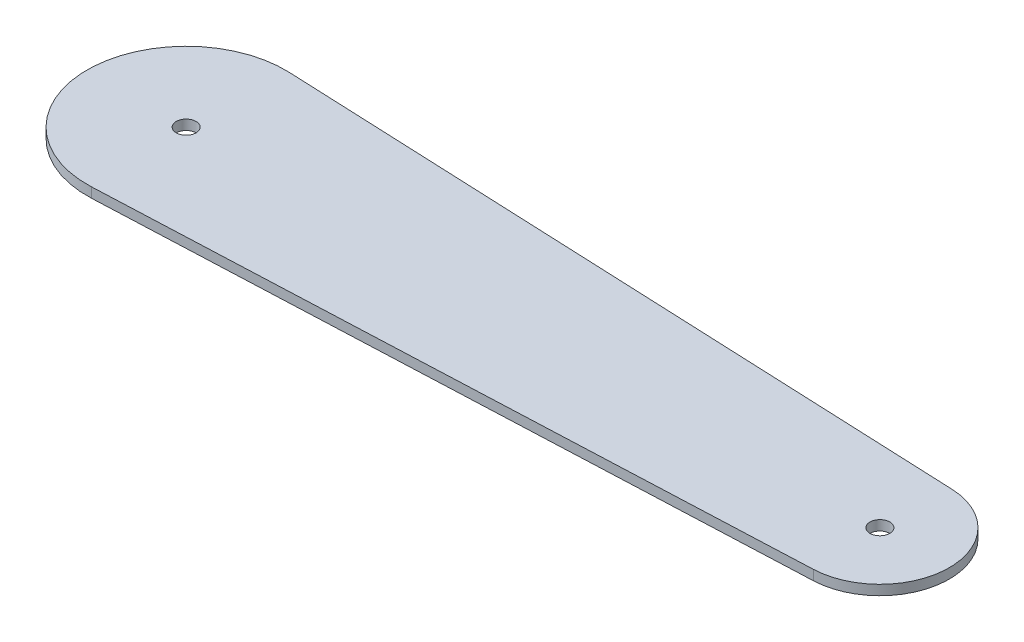
from build123d import *

# Parameters (mm, degrees)
SKETCH1_R           = 5
BOSS_EXTRUDE1_DEPTH = 5


with BuildPart() as part:
    # Sketch1 → Boss-Extrude1 (new body)
    with BuildSketch(Plane(origin=(0, 0, 0), x_dir=(1, 0, 0), z_dir=(0, 1, 0))):
        with BuildLine():
            Line((2.142857143, 49.954060528), (351.5, 34.96784237))
            ThreePointArc((351.5, 34.96784237), (385, 0), (351.5, -34.96784237))
            Line((351.5, -34.96784237), (2.142857143, -49.954060528))
            ThreePointArc((2.142857143, -49.954060528), (-50, 0), (2.142857143, 49.954060528))
        make_face()
        with Locations(Location((0, 0, 0), (0, 0, 270))):
            Circle(SKETCH1_R, mode=Mode.SUBTRACT)
        with Locations(Location((350, 0, 0), (0, 0, 270))):
            Circle(SKETCH1_R, mode=Mode.SUBTRACT)
    extrude(amount=BOSS_EXTRUDE1_DEPTH)


solid = part.part
